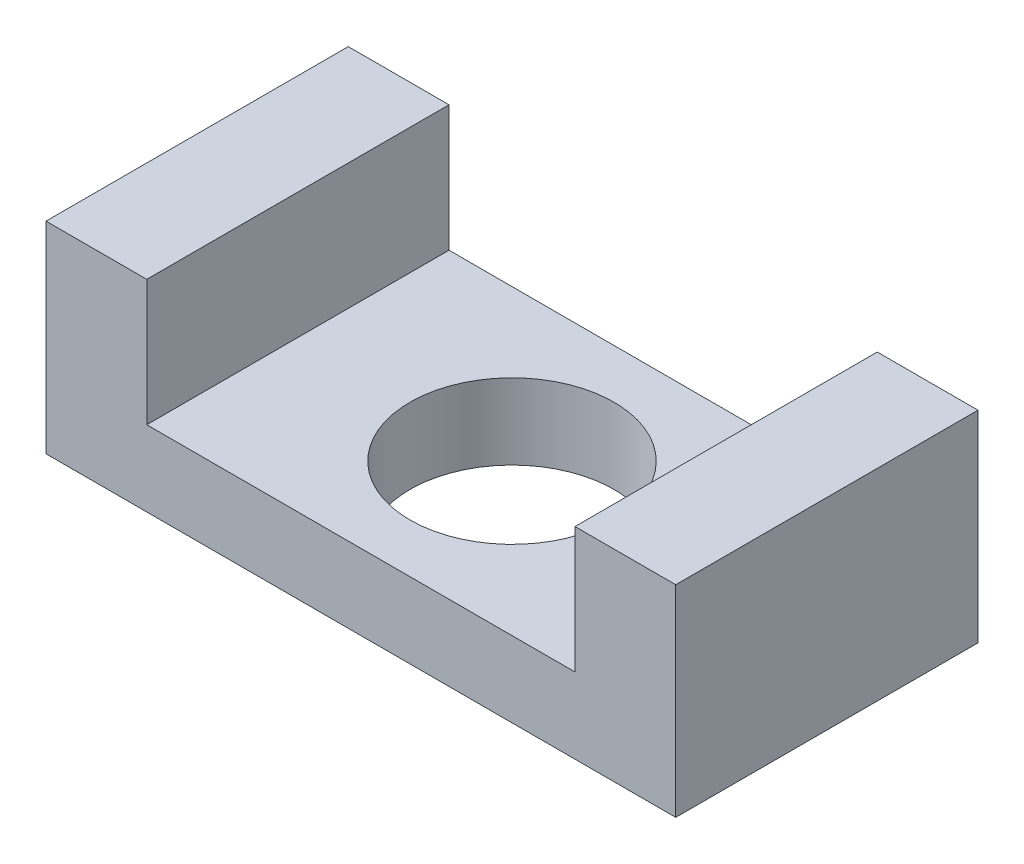
from build123d import *

# Parameters (mm, degrees)
SKETCH1_W           = 25
SKETCH1_H           = 12
SKETCH1_R           = 4.05
BOSS_EXTRUDE1_DEPTH = 3
SKETCH2_W           = 4
SKETCH2_H           = 12
BOSS_EXTRUDE2_DEPTH = 5


with BuildPart() as part:
    # Sketch1 → Boss-Extrude1 (new body)
    with BuildSketch(Plane(origin=(0, 0, 0), x_dir=(1, 0, 0), z_dir=(0, 1, 0))):
        Rectangle(SKETCH1_W, SKETCH1_H)
        with Locations(Location((0, 0, 0), (0, 0, 270))):
            Circle(SKETCH1_R, mode=Mode.SUBTRACT)
    extrude(amount=BOSS_EXTRUDE1_DEPTH)

    # Sketch2 → Boss-Extrude2 (add)
    with BuildSketch(Plane(origin=(0, 3, 0), x_dir=(1, 0, 0), z_dir=(0, 1, 0))):
        with Locations((-10.5, 0)):
            Rectangle(SKETCH2_W, SKETCH2_H)
        with Locations((10.5, 0)):
            Rectangle(SKETCH2_W, SKETCH2_H)
    extrude(amount=BOSS_EXTRUDE2_DEPTH)


solid = part.part
